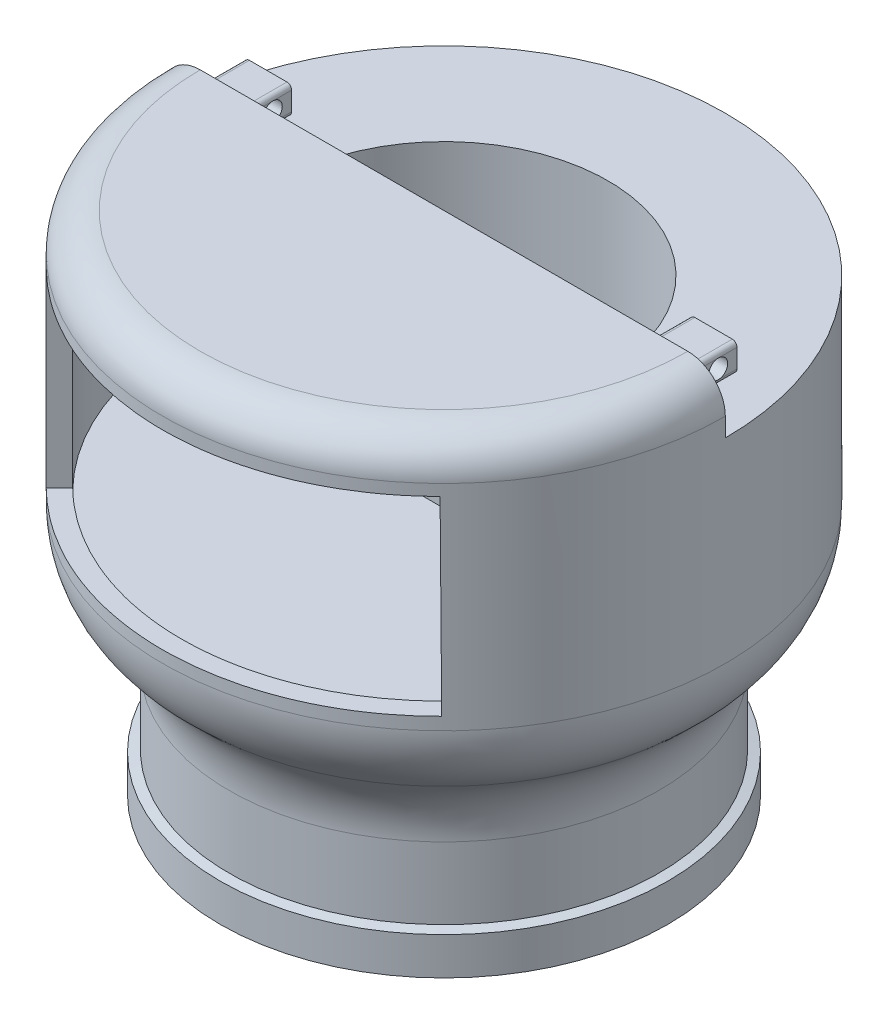
from build123d import *

# Parameters (mm, degrees)
CUT_EXTRUDE3_DEPTH           = 25
CUT_EXTRUDE3_DEPTH_BACK      = 40
CUT_EXTRUDE5_DEPTH           = 2
CUT_EXTRUDE5_DEPTH_BACK      = 5
BOSS_EXTRUDE2_DEPTH          = 5
CUT_EXTRUDE6_DEPTH           = 22
SKETCH17_W                   = 7
SKETCH17_H                   = 20.303986046
CUT_REVOLVE1_ANGLE           = 45
CUT_REVOLVE1_OTHER_WAY_ANGLE = 45
SKETCH14_R                   = 1
CUT_EXTRUDE7_DEPTH           = 10
CUT_EXTRUDE8_START           = -10
SKETCH15_R                   = 1
CUT_EXTRUDE8_DEPTH           = 10


with BuildPart() as part:
    # Sketch1 → Revolve1 (revolve)
    with BuildSketch(Plane.XY, mode=Mode.PRIVATE) as revolve1_sk:
        with BuildLine():
            Line((20.9, 0), (23.871591838, 0))
            Line((23.871591838, 0), (23.871591838, 4))
            Line((23.871591838, 4), (22.9, 4.236662843))
            Line((22.9, 4.236662843), (22.9, 11.874576818))
            ThreePointArc((22.9, 11.874576818), (23.83692213, 16.100759435), (26.472123903, 19.535021249))
            Line((26.472123903, 19.535021249), (26.427876097, 19.497892931))
            ThreePointArc((26.427876097, 19.497892931), (29.06307787, 22.932154745), (30, 27.158337362))
            Line((30, 27.158337362), (30, 50))
            ThreePointArc((30, 50), (28.828427125, 52.828427125), (26, 54))
            Line((26, 54), (0, 54))
            Line((0, 54), (0, 15))
            Line((0, 15), (19.9, 15))
            ThreePointArc((19.9, 15), (20.607106781, 14.707106781), (20.9, 14))
            Line((20.9, 14), (20.9, 0))
        make_face()
    revolve(revolve1_sk.sketch.rotate(Axis((0, 0, 0), (0, 1, 0)), 90), axis=Axis((0, 0, 0), (0, 1, 0)))

    # Sketch11 → Cut-Extrude3 (cut, two sides: drawn at the far end of the back side and taken through both)
    with BuildSketch(Plane(origin=(0, 19.535021249, 0), x_dir=(-1, 0, 0), z_dir=(0, -1, 0)).offset(-CUT_EXTRUDE3_DEPTH_BACK)):
        with BuildLine():
            Line((-17.5, 0), (17.5, 0))
            ThreePointArc((17.5, 0), (0, 17.5), (-17.5, 0))
        make_face()
    extrude(amount=CUT_EXTRUDE3_DEPTH + CUT_EXTRUDE3_DEPTH_BACK, mode=Mode.SUBTRACT)

    # Sketch9 → Cut-Extrude5 (cut, two sides: drawn at the far end of the back side and taken through both)
    with BuildSketch(Plane(origin=(0, 50, 0), x_dir=(-1, 0, 0), z_dir=(0, -1, 0)).offset(-CUT_EXTRUDE5_DEPTH_BACK)):
        with BuildLine():
            Line((-30, 0), (30, 0))
            ThreePointArc((30, 0), (0, 30), (-30, 0))
        make_face()
    extrude(amount=CUT_EXTRUDE5_DEPTH + CUT_EXTRUDE5_DEPTH_BACK, mode=Mode.SUBTRACT)

    # Sketch13 → Boss-Extrude2 (add)
    with BuildSketch(Plane(origin=(0, 0, 0), x_dir=(-1, 0, 0), z_dir=(0, 0, -1))):
        with BuildLine():
            Line((21.75, 52.5), (25.75, 52.5))
            ThreePointArc((25.75, 52.5), (26.103553391, 52.353553391), (26.25, 52))
            Line((26.25, 52), (26.25, 50))
            ThreePointArc((26.25, 50), (26.103553391, 49.646446609), (25.75, 49.5))
            Line((25.75, 49.5), (21.75, 49.5))
            ThreePointArc((21.75, 49.5), (21.396446609, 49.646446609), (21.25, 50))
            Line((21.25, 50), (21.25, 52))
            ThreePointArc((21.25, 52), (21.396446609, 52.353553391), (21.75, 52.5))
        make_face()
        with BuildLine():
            Line((-25.75, 52.5), (-21.75, 52.5))
            ThreePointArc((-21.75, 52.5), (-21.396446609, 52.353553391), (-21.25, 52))
            Line((-21.25, 52), (-21.25, 50))
            ThreePointArc((-21.25, 50), (-21.396446609, 49.646446609), (-21.75, 49.5))
            Line((-21.75, 49.5), (-25.75, 49.5))
            ThreePointArc((-25.75, 49.5), (-26.103553391, 49.646446609), (-26.25, 50))
            Line((-26.25, 50), (-26.25, 52))
            ThreePointArc((-26.25, 52), (-26.103553391, 52.353553391), (-25.75, 52.5))
        make_face()
    extrude(amount=BOSS_EXTRUDE2_DEPTH)

    # Sketch16 → Cut-Extrude6 (cut)
    with BuildSketch(Plane(origin=(0, 50, 0), x_dir=(-1, 0, 0), z_dir=(0, -1, 0))):
        with BuildLine():
            Line((27.95979256, -1.5), (-27.95979256, -1.5))
            ThreePointArc((-27.95979256, -1.5), (0, -28), (27.95979256, -1.5))
        make_face()
    extrude(amount=CUT_EXTRUDE6_DEPTH, mode=Mode.SUBTRACT)

    # Sketch17 → Cut-Revolve1 (revolve, cut)
    with BuildSketch(Plane(origin=(0, 0, 0), x_dir=(0, 0, -1), z_dir=(1, 0, 0))):
        with Locations((-28.883918314, 38.580330385)):
            Rectangle(SKETCH17_W, SKETCH17_H)
    revolve(axis=Axis((0, 0, 0), (0, 0.9999633813881498, 0.008557796607647805)), revolution_arc=CUT_REVOLVE1_ANGLE, mode=Mode.SUBTRACT)

    # Sketch17 → Cut-Revolve1 other way (revolve, cut)
    with BuildSketch(Plane(origin=(0, 0, 0), x_dir=(0, 0, -1), z_dir=(1, 0, 0))):
        with Locations((-28.883918314, 38.580330385)):
            Rectangle(SKETCH17_W, SKETCH17_H)
    revolve(axis=Axis((0, 0, 0), (0, -0.9999633813881498, -0.008557796607647805)), revolution_arc=CUT_REVOLVE1_OTHER_WAY_ANGLE, mode=Mode.SUBTRACT)

    # Sketch14 → Cut-Extrude7 (cut)
    with BuildSketch(Plane.ZY.offset(-21.25)):
        with Locations(Location((-3, 51, 0), (0, 0, 270))):
            Circle(SKETCH14_R)
    extrude(amount=-CUT_EXTRUDE7_DEPTH, mode=Mode.SUBTRACT)

    # Sketch15 → Cut-Extrude8 (cut)
    with BuildSketch(Plane(origin=(-21.25, 0, 0), x_dir=(0, 0, -1), z_dir=(1, 0, 0)).offset(CUT_EXTRUDE8_START)):
        with Locations(Location((3, 51, 0), (0, 0, 270))):
            Circle(SKETCH15_R)
    extrude(amount=CUT_EXTRUDE8_DEPTH, mode=Mode.SUBTRACT)


solid = part.part
